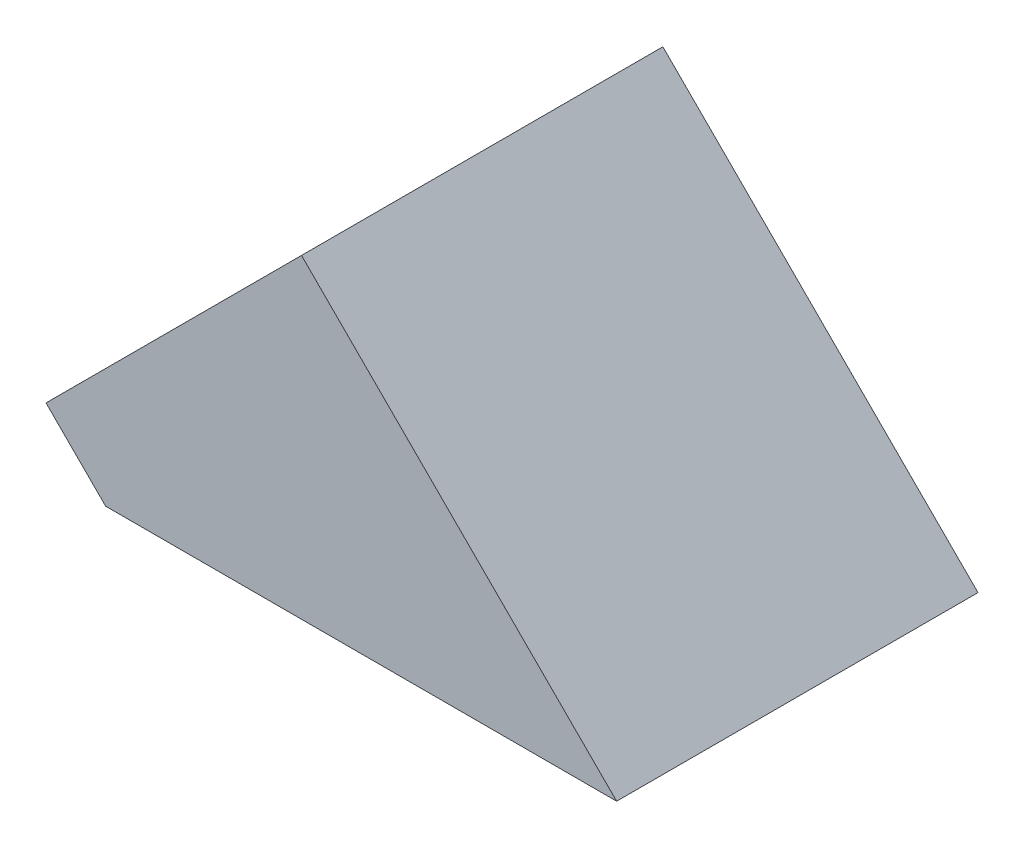
from build123d import *

# Parameters (mm, degrees)
EXTRUDE_1_DEPTH = 30


with BuildPart() as part:
    # 草图1 → 凸台-拉伸1 (new body)
    with BuildSketch(Plane.XY):
        Polygon((0, 0), (42.426406871, 0), (16.263455967, 26.162950904), (-4.949747468, 4.949747468), align=None)
    extrude(amount=EXTRUDE_1_DEPTH)


solid = part.part
